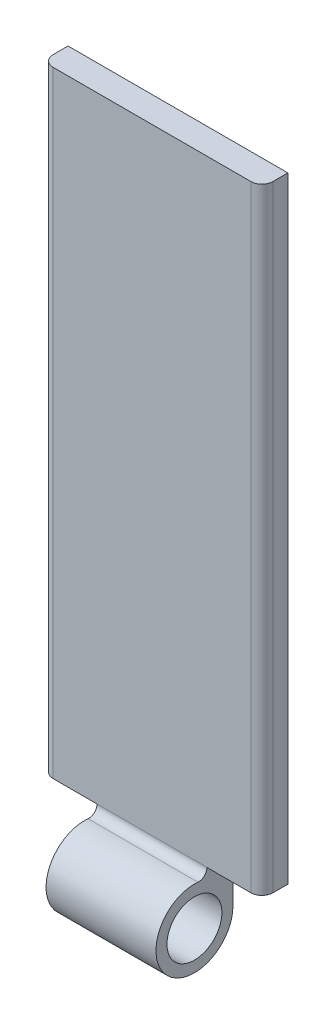
from build123d import *

# Parameters (mm, degrees)
SKETCH2_R               = 1.5875
BOSS_EXTRUDE1_DEPTH     = 12.7
CUT_EXTRUDE3_DEPTH      = 12.7
CUT_EXTRUDE3_DEPTH_BACK = 12.7
SKETCH4_W               = 3.175
SKETCH4_H               = 5.378529074
SKETCH4_W_2             = 3.429175225
FILLET4_R               = 0.635
SCALE1_SCALE            = 3


with BuildPart() as part:
    # Sketch2 → Boss-Extrude1 (new body)
    with BuildSketch(Plane(origin=(0, 0, 0), x_dir=(0, 0, -1), z_dir=(1, 0, 0))):
        with BuildLine():
            Line((0.7234417, 2.689264537), (0.7234417, 38.281333312))
            Line((0.7234417, 38.281333312), (2.2225, 38.281333312))
            Line((2.2225, 38.281333312), (2.2225, 0))
            ThreePointArc((2.2225, 0), (-1.641425032, -1.498409194), (0.202045455, 2.213297062))
            ThreePointArc((0.202045455, 2.213297062), (0.567726646, 2.33627761), (0.7234417, 2.689264537))
        make_face()
        Circle(SKETCH2_R, mode=Mode.SUBTRACT)
    extrude(amount=BOSS_EXTRUDE1_DEPTH)

    # Sketch4 → Cut-Extrude3 (cut, two sides: drawn at the far end of the back side and taken through both)
    with BuildSketch(Plane.XY.offset(-0.7234417).offset(-CUT_EXTRUDE3_DEPTH_BACK)):
        with Locations((1.5875, 0)):
            Rectangle(SKETCH4_W, SKETCH4_H)
        with Locations((11.239587612, 0)):
            Rectangle(SKETCH4_W_2, SKETCH4_H)
    extrude(amount=CUT_EXTRUDE3_DEPTH + CUT_EXTRUDE3_DEPTH_BACK, mode=Mode.SUBTRACT)

    # Fillet4
    fillet4_edges = [part.edges().sort_by_distance(p)[0] for p in [
        (0, 20.485298925, -0.7234417),
        (12.7, 20.485298925, -0.7234417),
    ]]
    fillet(fillet4_edges, radius=FILLET4_R)


with BuildPart() as part_1:
    # Scale1: scaled about (6.35, 18.844068161, -1.382882034)
    add(part.part.scale(SCALE1_SCALE).moved(Location((-12.7, -37.688136322, 2.765764068))))


solid = part_1.part
